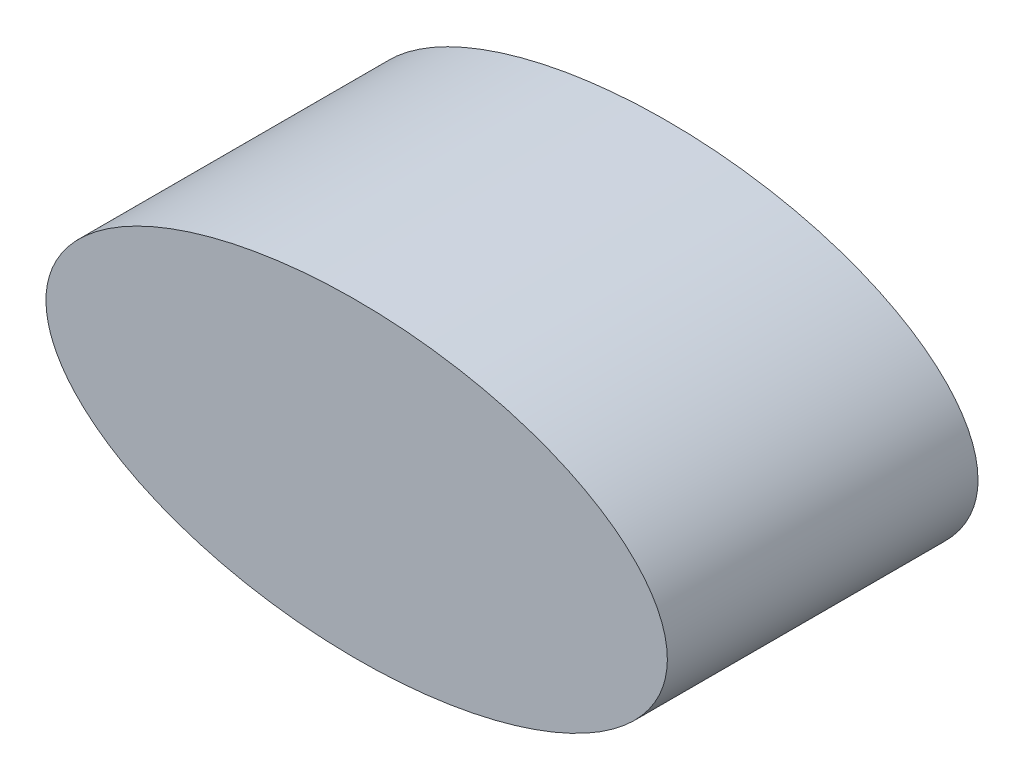
from build123d import *

# Parameters (mm, degrees)
SKETCH1_RX          = 5
SKETCH1_RY          = 2.5
BOSS_EXTRUDE1_DEPTH = 5


with BuildPart() as part:
    # Sketch1 → Boss-Extrude1 (new body)
    with BuildSketch(Plane.XY):
        with Locations((20, 15)):
            Ellipse(SKETCH1_RX, SKETCH1_RY)
    extrude(amount=BOSS_EXTRUDE1_DEPTH)


solid = part.part
